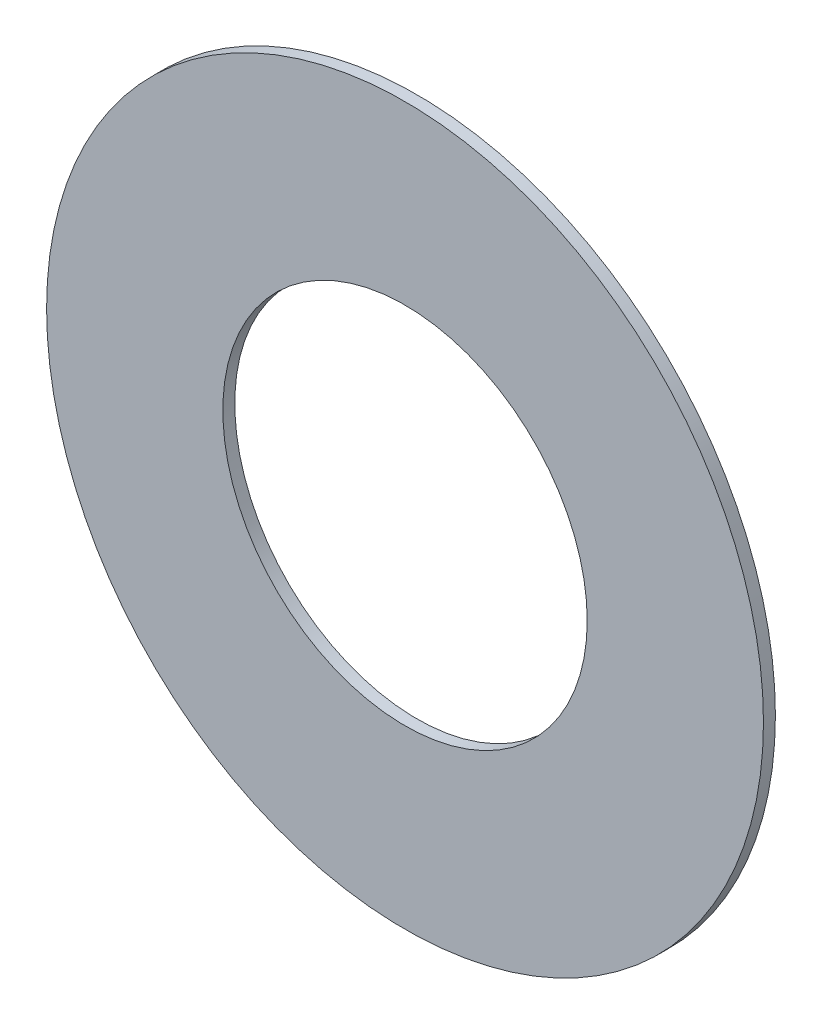
from build123d import *

# Parameters (mm, degrees)
SKETCH1_R           = 12
SKETCH1_R_2         = 6.1
BOSS_EXTRUDE1_DEPTH = 0.4


with BuildPart() as part:
    # Sketch1 → Boss-Extrude1 (new body)
    with BuildSketch(Plane.XY):
        Circle(SKETCH1_R)
        Circle(SKETCH1_R_2, mode=Mode.SUBTRACT)
    extrude(amount=BOSS_EXTRUDE1_DEPTH)


solid = part.part
